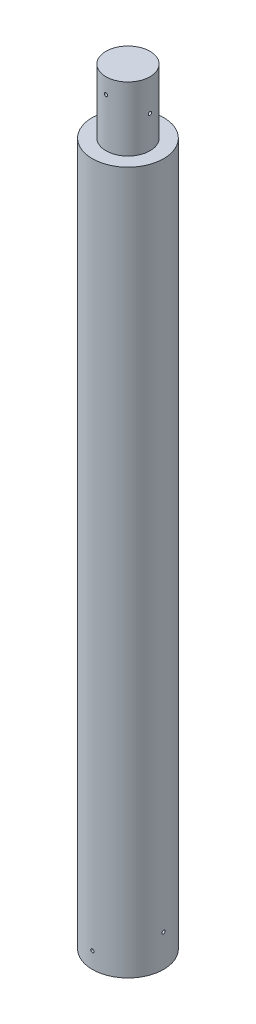
from build123d import *

# Parameters (mm, degrees)
SKETCH1_R               = 11
BOSS_EXTRUDE1_DEPTH     = 216.66667
BOSS_EXTRUDE2_START     = 216.66667
SKETCH2_R               = 6.8
BOSS_EXTRUDE2_DEPTH     = 19.8
CUT_EXTRUDE1_START      = -1.44
SKETCH3_R               = 0.5
CUT_EXTRUDE1_DEPTH      = 9
CUT_EXTRUDE2_START      = -1.4
SKETCH4_R               = 0.5
CUT_EXTRUDE2_DEPTH      = 9
SKETCH6_R               = 7
CUT_EXTRUDE3_DEPTH      = 20
CUT_EXTRUDE4_DEPTH      = 237.977817671
CUT_EXTRUDE4_DEPTH_BACK = 237.977817671
SKETCH7_R               = 0.5
CUT_EXTRUDE5_DEPTH      = 237.97781768
CUT_EXTRUDE5_DEPTH_BACK = 237.97781768
SKETCH10_R              = 0.5


with BuildPart() as part:
    # Sketch1 → Boss-Extrude1 (new body)
    with BuildSketch(Plane(origin=(0, 0, 0), x_dir=(1, 0, 0), z_dir=(0, 1, 0))):
        with Locations(Location((0, 0, 0), (0, 0, 270))):
            Circle(SKETCH1_R)
    extrude(amount=BOSS_EXTRUDE1_DEPTH)

    # Sketch2 → Boss-Extrude2 (add)
    with BuildSketch(Plane(origin=(0, 0, 0), x_dir=(1, 0, 0), z_dir=(0, 1, 0)).offset(BOSS_EXTRUDE2_START)):
        with Locations(Location((0, 0, 0), (0, 0, 90))):
            Circle(SKETCH2_R)
    extrude(amount=BOSS_EXTRUDE2_DEPTH)

    # Sketch3 → Cut-Extrude1 (cut)
    with BuildSketch(Plane.XY.offset(CUT_EXTRUDE1_START)):
        with Locations((0, 231.66667)):
            Circle(SKETCH3_R)
    cut_extrude1 = extrude(amount=-CUT_EXTRUDE1_DEPTH, mode=Mode.SUBTRACT)

    # Mirror1: Cut-Extrude1 across plane
    add(cut_extrude1.mirror(Plane.XY), mode=Mode.SUBTRACT)

    # Sketch4 → Cut-Extrude2 (cut)
    with BuildSketch(Plane(origin=(0, 0, 0), x_dir=(0, 0, -1), z_dir=(1, 0, 0)).offset(CUT_EXTRUDE2_START)):
        with Locations((0, 226.66667)):
            Circle(SKETCH4_R)
    cut_extrude2 = extrude(amount=-CUT_EXTRUDE2_DEPTH, mode=Mode.SUBTRACT)

    # Mirror2: Cut-Extrude2 across plane
    add(cut_extrude2.mirror(Plane(origin=(0, 0, 0), x_dir=(0, 0, 1), z_dir=(1, 0, 0))), mode=Mode.SUBTRACT)

    # Sketch6 → Cut-Extrude3 (cut)
    with BuildSketch(Plane(origin=(0, 0, 0), x_dir=(1, 0, 0), z_dir=(0, 1, 0))):
        with Locations(Location((0, 0, 0), (0, 0, 270))):
            Circle(SKETCH6_R)
    extrude(amount=CUT_EXTRUDE3_DEPTH, mode=Mode.SUBTRACT)

    # Sketch7 → Cut-Extrude4 (cut, two sides: drawn at the far end of the back side and taken through both)
    with BuildSketch(Plane(origin=(0, 0, 0), x_dir=(0, 0, -1), z_dir=(1, 0, 0)).offset(-CUT_EXTRUDE4_DEPTH_BACK)):
        with Locations((0, 10)):
            Circle(SKETCH7_R)
    extrude(amount=CUT_EXTRUDE4_DEPTH + CUT_EXTRUDE4_DEPTH_BACK, mode=Mode.SUBTRACT)

    # Sketch10 → Cut-Extrude5 (cut, two sides: drawn at the far end of the back side and taken through both)
    with BuildSketch(Plane.XY.offset(-CUT_EXTRUDE5_DEPTH_BACK)):
        with Locations((0, 5)):
            Circle(SKETCH10_R)
    extrude(amount=CUT_EXTRUDE5_DEPTH + CUT_EXTRUDE5_DEPTH_BACK, mode=Mode.SUBTRACT)


solid = part.part
